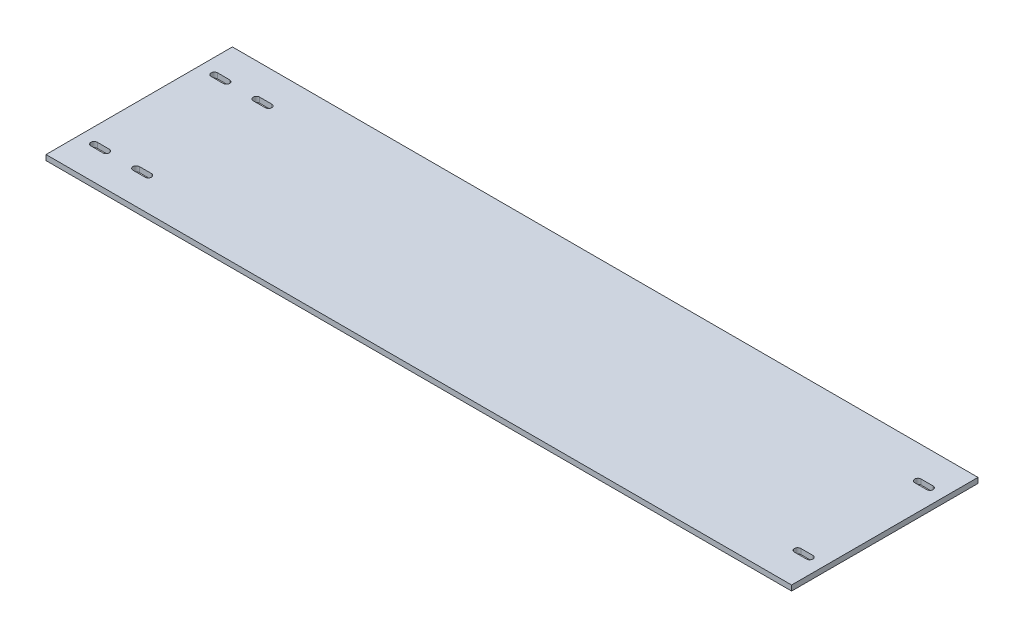
from build123d import *

# Parameters (mm, degrees)
SKETCH1_W           = 787.4
SKETCH1_H           = 196.85
BOSS_EXTRUDE1_DEPTH = 5.588


with BuildPart() as part:
    # Sketch1 → Boss-Extrude1 (new body)
    with BuildSketch(Plane(origin=(0, 0, 0), x_dir=(1, 0, 0), z_dir=(0, 1, 0))):
        with Locations((393.7, 98.425)):
            Rectangle(SKETCH1_W, SKETCH1_H)
        with BuildLine():
            Line((15.875, 38.3032), (28.575, 38.3032))
            ThreePointArc((28.575, 38.3032), (31.9532, 34.925), (28.575, 31.5468))
            Line((28.575, 31.5468), (15.875, 31.5468))
            ThreePointArc((15.875, 31.5468), (12.4968, 34.925), (15.875, 38.3032))
        make_face(mode=Mode.SUBTRACT)
        with BuildLine():
            Line((15.875, 165.3032), (28.575, 165.3032))
            ThreePointArc((28.575, 165.3032), (31.9532, 161.925), (28.575, 158.5468))
            Line((28.575, 158.5468), (15.875, 158.5468))
            ThreePointArc((15.875, 158.5468), (12.4968, 161.925), (15.875, 165.3032))
        make_face(mode=Mode.SUBTRACT)
        with BuildLine():
            Line((60.325, 165.3032), (73.025, 165.3032))
            ThreePointArc((73.025, 165.3032), (76.4032, 161.925), (73.025, 158.5468))
            Line((73.025, 158.5468), (60.325, 158.5468))
            ThreePointArc((60.325, 158.5468), (56.9468, 161.925), (60.325, 165.3032))
        make_face(mode=Mode.SUBTRACT)
        with BuildLine():
            Line((60.325, 38.3032), (73.025, 38.3032))
            ThreePointArc((73.025, 38.3032), (76.4032, 34.925), (73.025, 31.5468))
            Line((73.025, 31.5468), (60.325, 31.5468))
            ThreePointArc((60.325, 31.5468), (56.9468, 34.925), (60.325, 38.3032))
        make_face(mode=Mode.SUBTRACT)
        with BuildLine():
            Line((771.525, 158.5468), (758.825, 158.5468))
            ThreePointArc((758.825, 158.5468), (755.4468, 161.925), (758.825, 165.3032))
            Line((758.825, 165.3032), (771.525, 165.3032))
            ThreePointArc((771.525, 165.3032), (774.9032, 161.925), (771.525, 158.5468))
        make_face(mode=Mode.SUBTRACT)
        with BuildLine():
            Line((771.525, 31.5468), (758.825, 31.5468))
            ThreePointArc((758.825, 31.5468), (755.4468, 34.925), (758.825, 38.3032))
            Line((758.825, 38.3032), (771.525, 38.3032))
            ThreePointArc((771.525, 38.3032), (774.9032, 34.925), (771.525, 31.5468))
        make_face(mode=Mode.SUBTRACT)
    extrude(amount=BOSS_EXTRUDE1_DEPTH)


solid = part.part
